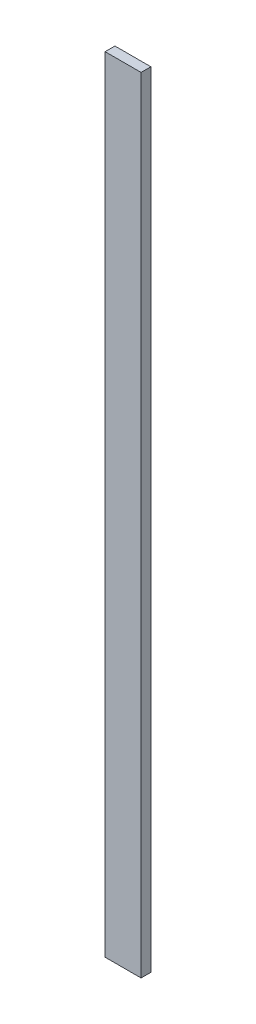
from build123d import *

# Parameters (mm, degrees)
SKETCH1_W           = 139.7
SKETCH1_H           = 3048
BOSS_EXTRUDE1_DEPTH = 38.1


with BuildPart() as part:
    # Sketch1 → Boss-Extrude1 (new body)
    with BuildSketch(Plane.XY):
        with Locations((54.145510202, 1472.515177776)):
            Rectangle(SKETCH1_W, SKETCH1_H)
    extrude(amount=BOSS_EXTRUDE1_DEPTH)


solid = part.part
